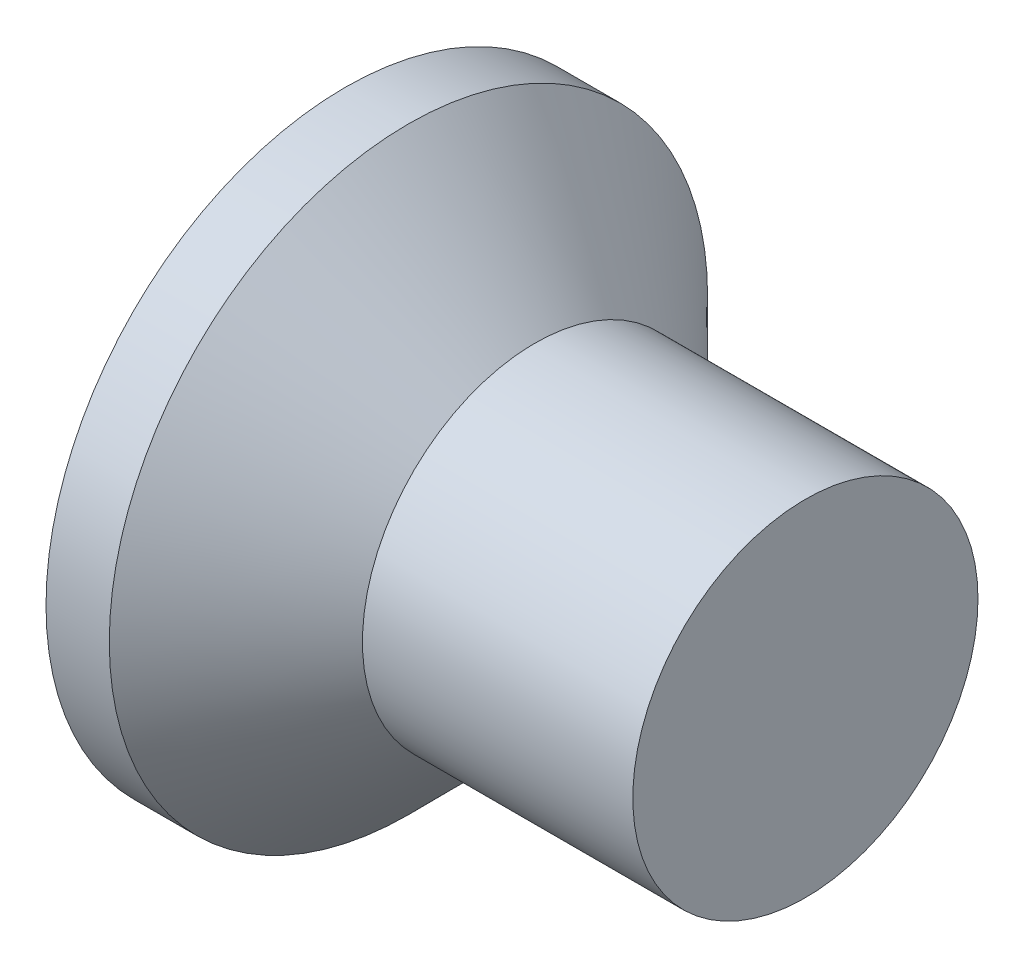
from build123d import *

# Parameters (mm, degrees)
CROSSRECESS_DEPTH = 0.825
DRAFT9_ANGLE      = 30
FILLET5_R         = 0.3


with BuildPart() as part:
    # Sketch1 → Base (revolve)
    with BuildSketch(Plane.XY, mode=Mode.PRIVATE) as base_sk:
        Polygon((4, 1.5), (2.65, 1.5), (1.65, 1.5), (0.55, 2.6), (0, 2.6), (0, 0), (4, 0), align=None)
    revolve(base_sk.sketch.rotate(Axis((4.515812911, 0, 0), (-1, 0, 0)), 90), axis=Axis((4.515812911, 0, 0), (-1, 0, 0)))

    # Sketch6 → CrossRecess (cut)
    with BuildSketch(Plane(origin=(0, 0, 0), x_dir=(0, 0, -1), z_dir=(1, 0, 0))):
        Polygon((0.32, 0.32), (0.32, 1.6), (-0.32, 1.6), (-0.32, 0.32), (-1.6, 0.32), (-1.6, -0.32), (-0.32, -0.32), (-0.32, -1.6), (0.32, -1.6), (0.32, -0.32), (1.6, -0.32), (1.6, 0.32), align=None)
    extrude(amount=CROSSRECESS_DEPTH, mode=Mode.SUBTRACT)

    # Draft9
    draft9_faces = [part.faces().sort_by_distance(p)[0] for p in [
        (0.4125, 1.6, 0),
        (0.4125, 0, 1.6),
        (0.4125, -1.6, 0),
        (0.4125, 0, -1.6),
    ]]
    draft(draft9_faces, Plane(origin=(0, 2.6, 0), x_dir=(0, 0, -1), z_dir=(-1, 0, 0)), DRAFT9_ANGLE)

    # Fillet5
    fillet5_edges = [part.edges().sort_by_distance(p)[0] for p in [
        (0.4125, 0.32, 0.32),
        (0.4125, -0.32, 0.32),
        (0.4125, -0.32, -0.32),
        (0.4125, 0.32, -0.32),
    ]]
    fillet(fillet5_edges, radius=FILLET5_R)


solid = part.part
